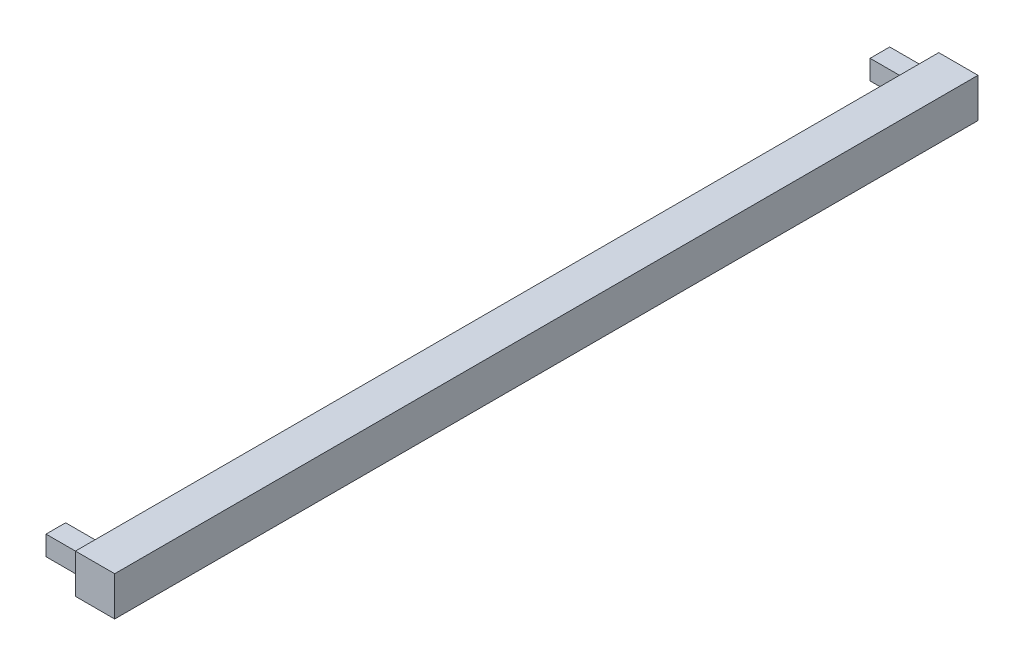
from build123d import *

# Parameters (mm, degrees)
SKETCH1_W           = 5
SKETCH1_H           = 5
BOSS_EXTRUDE1_DEPTH = 110
SKETCH2_W           = 2.5
SKETCH2_H           = 2.5
BOSS_EXTRUDE2_DEPTH = 5


with BuildPart() as part:
    # Sketch1 → Boss-Extrude1 (new body)
    with BuildSketch(Plane.XY):
        with Locations((2.5, 2.5)):
            Rectangle(SKETCH1_W, SKETCH1_H)
    extrude(amount=BOSS_EXTRUDE1_DEPTH)

    # Sketch2 → Boss-Extrude2 (add)
    with BuildSketch(Plane.ZY):
        with Locations((2.5, 2.5)):
            Rectangle(SKETCH2_W, SKETCH2_H)
        with Locations((107.5, 2.5)):
            Rectangle(SKETCH2_W, SKETCH2_H)
    extrude(amount=BOSS_EXTRUDE2_DEPTH)


solid = part.part
